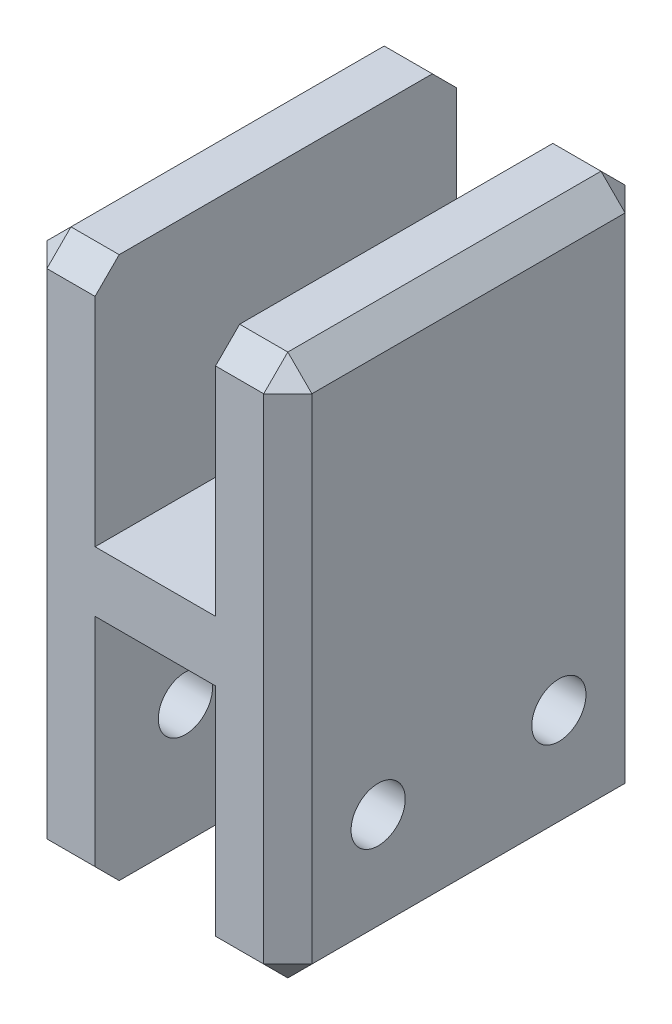
from build123d import *

# Parameters (mm, degrees)
ESTRUSIONE_ESTRUSIONE1_DEPTH                         = 30
FORO_LAMATO_PER_VITE_M4_A_TESTA_CILINDRI_D           = 4.5
FORO_LAMATO_PER_VITE_M4_A_TESTA_CILINDRI_DEPTH       = 30
FORO_LAMATO_PER_VITE_M4_A_TESTA_CILINDRI_CBORE_D     = 10
FORO_LAMATO_PER_VITE_M4_A_TESTA_CILINDRI_CBORE_DEPTH = 2.6
FORO_LAMATO_PER_VITE_M4_A_TESTA_CILINDRI_TIP         = 1.351936393
SMUSSO1_SIZE                                         = 2


with BuildPart() as part:
    # Schizzo1 → Estrusione-Estrusione1 (new body)
    with BuildSketch(Plane.XY):
        Polygon((11, -25), (11, 20), (5, 20), (5, 0), (-5, 0), (-5, 20), (-11, 20), (-11, -25), (-5, -25), (-5, -5), (5, -5), (5, -25), align=None)
    extrude(amount=ESTRUSIONE_ESTRUSIONE1_DEPTH)

    # Foro lamato per Vite M4 a testa cilindrica piana-1
    with Locations(Plane(origin=(-11, -15, 22.5), x_dir=(0, -1, 0), z_dir=(-1, 0, 0))):
        with Locations((0, 0), (0, -15)):
            CounterBoreHole(FORO_LAMATO_PER_VITE_M4_A_TESTA_CILINDRI_D / 2, FORO_LAMATO_PER_VITE_M4_A_TESTA_CILINDRI_CBORE_D / 2, FORO_LAMATO_PER_VITE_M4_A_TESTA_CILINDRI_CBORE_DEPTH, depth=FORO_LAMATO_PER_VITE_M4_A_TESTA_CILINDRI_DEPTH)
            with Locations((0, 0, -(FORO_LAMATO_PER_VITE_M4_A_TESTA_CILINDRI_DEPTH + FORO_LAMATO_PER_VITE_M4_A_TESTA_CILINDRI_TIP / 2))):  # 118° drill point
                Cone(0, FORO_LAMATO_PER_VITE_M4_A_TESTA_CILINDRI_D / 2, FORO_LAMATO_PER_VITE_M4_A_TESTA_CILINDRI_TIP, mode=Mode.SUBTRACT)

    # Smusso1
    smusso1_edges = [part.edges().sort_by_distance(p)[0] for p in [
        (-8, -25, 30),
        (8, 20, 0),
        (11, -2.5, 0),
        (8, -25, 0),
        (-8, -25, 0),
        (-11, -2.5, 0),
        (-8, 20, 0),
        (11, 20, 15),
        (11, -25, 15),
        (-11, -25, 15),
        (-11, 20, 15),
        (8, -25, 30),
        (11, -2.5, 30),
        (8, 20, 30),
        (-8, 20, 30),
        (-11, -2.5, 30),
    ]]
    chamfer(smusso1_edges, length=SMUSSO1_SIZE)


solid = part.part
